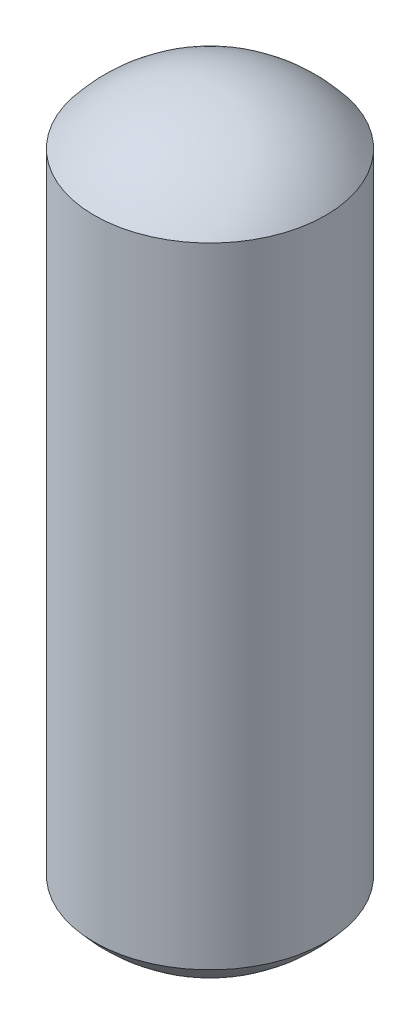
from build123d import *


with BuildPart() as part:
    # Sketch1 → Revolve1 (revolve)
    with BuildSketch(Plane.XY, mode=Mode.PRIVATE) as revolve1_sk:
        with BuildLine():
            Line((2.5, -1.2), (2.5, -14.8))
            ThreePointArc((2.5, -14.8), (1.386542462, -15.684463463), (0, -16))
            Line((0, -16), (0, 0))
            ThreePointArc((0, 0), (1.386542462, -0.315536537), (2.5, -1.2))
        make_face()
    revolve(revolve1_sk.sketch.rotate(Axis((0, 5, 0), (0, -1, 0)), 180), axis=Axis((0, 5, 0), (0, -1, 0)))


solid = part.part
